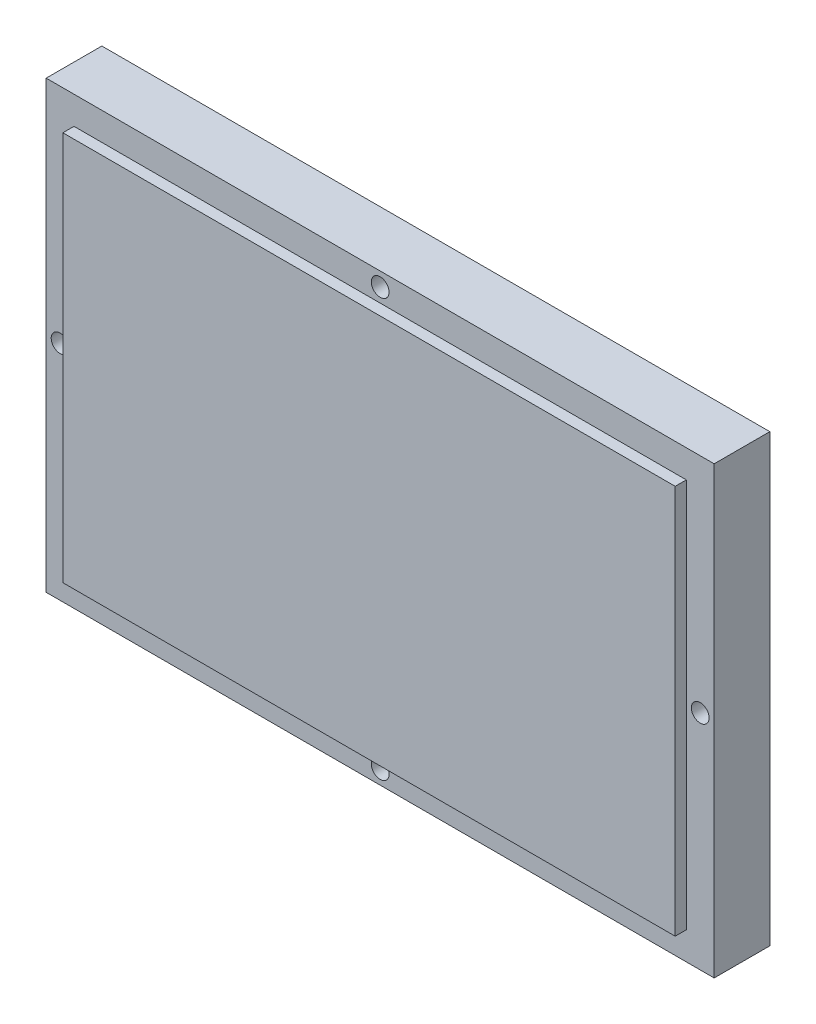
from build123d import *

# Parameters (mm, degrees)
SKETCH1_W           = 76.2
SKETCH1_H           = 50.8
BOSS_EXTRUDE1_DEPTH = 7.62
CUT_EXTRUDE3_DEPTH  = 1.27
SKETCH5_R           = 1.016
CUT_EXTRUDE4_DEPTH  = 92.800885072


with BuildPart() as part:
    # Sketch1 → Boss-Extrude1 (new body)
    with BuildSketch(Plane.XY):
        with Locations((38.1, 25.4)):
            Rectangle(SKETCH1_W, SKETCH1_H)
    extrude(amount=BOSS_EXTRUDE1_DEPTH)

    # Sketch4 → Cut-Extrude3 (cut)
    with BuildSketch(Plane.XY.offset(7.62)):
        Polygon((38.1, 47.625), (38.1, 50.8), (0, 50.8), (0, 0), (38.1, 0), (38.1, 3.175), (3.175, 3.175), (3.175, 47.625), align=None)
        Polygon((76.2, 50.8), (38.1, 50.8), (38.1, 47.625), (73.025, 47.625), (73.025, 3.175), (38.1, 3.175), (38.1, 0), (76.2, 0), align=None)
    extrude(amount=-CUT_EXTRUDE3_DEPTH, mode=Mode.SUBTRACT)

    # Sketch5 → Cut-Extrude4 (cut, through all)
    with BuildSketch(Plane.XY.offset(6.35)):
        with Locations((1.5875, 25.4)):
            Circle(SKETCH5_R)
        with Locations((38.1, 49.2125)):
            Circle(SKETCH5_R)
        with Locations((74.6125, 25.4)):
            Circle(SKETCH5_R)
        with Locations((38.1, 1.5875)):
            Circle(SKETCH5_R)
    extrude(amount=-CUT_EXTRUDE4_DEPTH, mode=Mode.SUBTRACT)


solid = part.part
